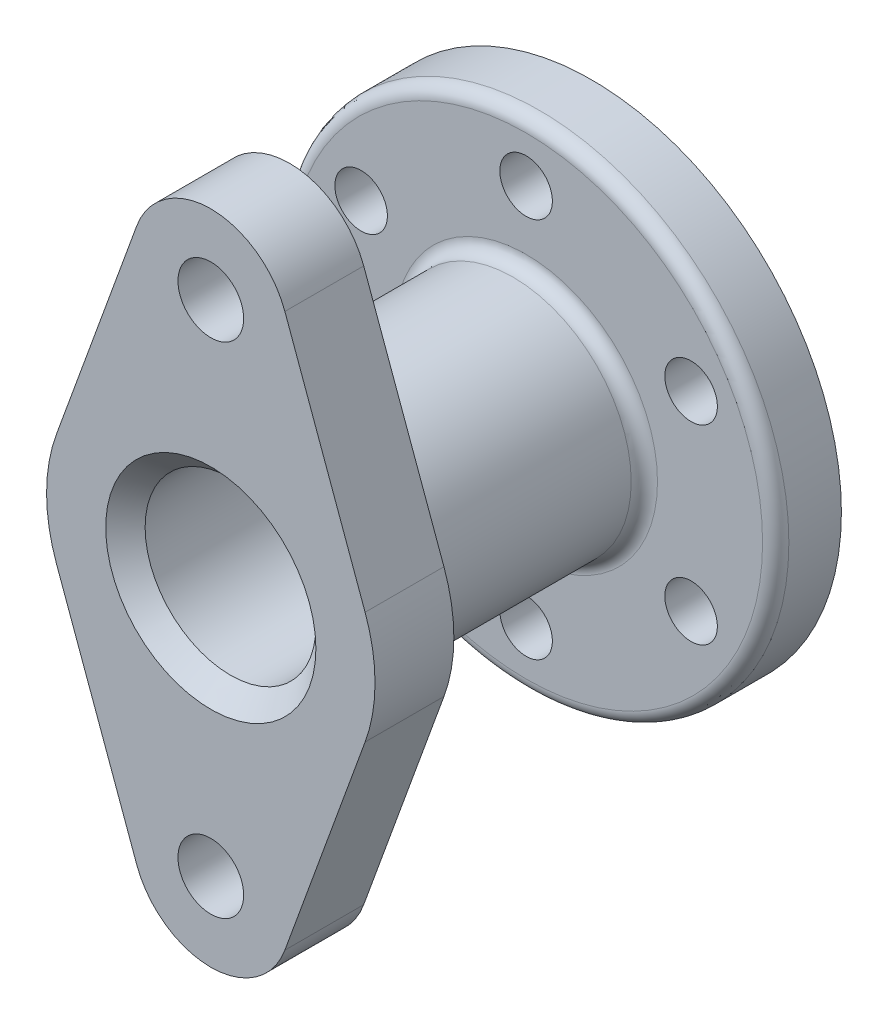
from build123d import *

# Parameters (mm, degrees)
SKETCH_2_R               = 4
CUT_EXTRUDE_1_DEPTH      = 73.055534139
PATTERN_CIRCULAR_1_COUNT = 6
SKETCH_3_R               = 5
SKETCH_3_R_2             = 25
SKETCH_3_R_3             = 18
EXTRUDE_2_DEPTH          = 12
CHAMFER_1_SIZE           = 3
FILLET_1_R               = 2


with BuildPart() as part:
    # 草圖1 → 旋轉1 (revolve)
    with BuildSketch(Plane(origin=(0, 0, 0), x_dir=(0, 0, -1), z_dir=(1, 0, 0)), mode=Mode.PRIVATE) as revolve_1_sk:
        Polygon((0, 0), (0, 38), (-10, 38), (-10, 18), (-58, 18), (-58, 0), align=None)
    revolve(revolve_1_sk.sketch.rotate(Axis((0, 0, 0), (0, 0, 1)), 90), axis=Axis((0, 0, 0), (0, 0, 1)))

    # 草圖2 → 伸長1 (cut, through all)
    with BuildSketch(Plane.XY.offset(10)):
        with Locations((0, 29)):
            Circle(SKETCH_2_R)
    cut_extrude_1 = extrude(amount=-CUT_EXTRUDE_1_DEPTH, mode=Mode.SUBTRACT)

    # 環狀複製排列1: 伸長1 ×6 about axis
    pattern_circular_1_axis = Axis((0, 0, 0), (0, 0, 1))
    for i in range(1, PATTERN_CIRCULAR_1_COUNT):
        add(cut_extrude_1.rotate(pattern_circular_1_axis, i * 360 / PATTERN_CIRCULAR_1_COUNT), mode=Mode.SUBTRACT)

    # 草圖3 → 伸長2 (add)
    # profile 1 of 3: a face of its own
    with BuildSketch(Plane.XY.offset(58)):
        with BuildLine():
            Line((-11.275939624, 42.105263158), (-23.491540883, 8.552631579))
            ThreePointArc((-23.491540883, 8.552631579), (0, 25), (23.491540883, 8.552631579))
            Line((23.491540883, 8.552631579), (11.275939624, 42.105263158))
            ThreePointArc((11.275939624, 42.105263158), (0, 50), (-11.275939624, 42.105263158))
        make_face()
        with Locations((0, 38)):
            Circle(SKETCH_3_R, mode=Mode.SUBTRACT)
    # profile 2 of 3: a face of its own
    with BuildSketch(Plane.XY.offset(58)):
        Circle(SKETCH_3_R_2)
        with Locations(Location((0, 0, 0), (0, 0, 180))):
            Circle(SKETCH_3_R_3, mode=Mode.SUBTRACT)
    # profile 3 of 3: a face of its own
    with BuildSketch(Plane.XY.offset(58)):
        with BuildLine():
            ThreePointArc((23.491540883, -8.552631579), (0, -25), (-23.491540883, -8.552631579))
            Line((-23.491540883, -8.552631579), (-11.275939624, -42.105263158))
            ThreePointArc((-11.275939624, -42.105263158), (0, -50), (11.275939624, -42.105263158))
            Line((11.275939624, -42.105263158), (23.491540883, -8.552631579))
        make_face()
        with Locations((0, -38)):
            Circle(SKETCH_3_R, mode=Mode.SUBTRACT)
    extrude(amount=-EXTRUDE_2_DEPTH)

    # 草圖4 → 除料-旋轉1 (revolve, cut)
    with BuildSketch(Plane(origin=(0, 0, 0), x_dir=(0, 0, -1), z_dir=(1, 0, 0)), mode=Mode.PRIVATE) as cut_revolve_1_sk:
        Polygon((-58, 0), (-58, 13), (-33, 13), (-33, 10), (0, 10), (0, 0), align=None)
    revolve(cut_revolve_1_sk.sketch.rotate(Axis((0, 0, 0), (0, 0, 1)), 90), axis=Axis((0, 0, 0), (0, 0, 1)), mode=Mode.SUBTRACT)

    # 導角1
    chamfer_1_edges = [part.edges().sort_by_distance(p)[0] for p in [
        (13, 0, 58),
    ]]
    chamfer(chamfer_1_edges, length=CHAMFER_1_SIZE)

    # 圓角1
    fillet_1_edges = [part.edges().sort_by_distance(p)[0] for p in [
        (18, 0, 46),
        (18, 0, 10),
        (38, 0, 10),
    ]]
    fillet(fillet_1_edges, radius=FILLET_1_R)


solid = part.part
